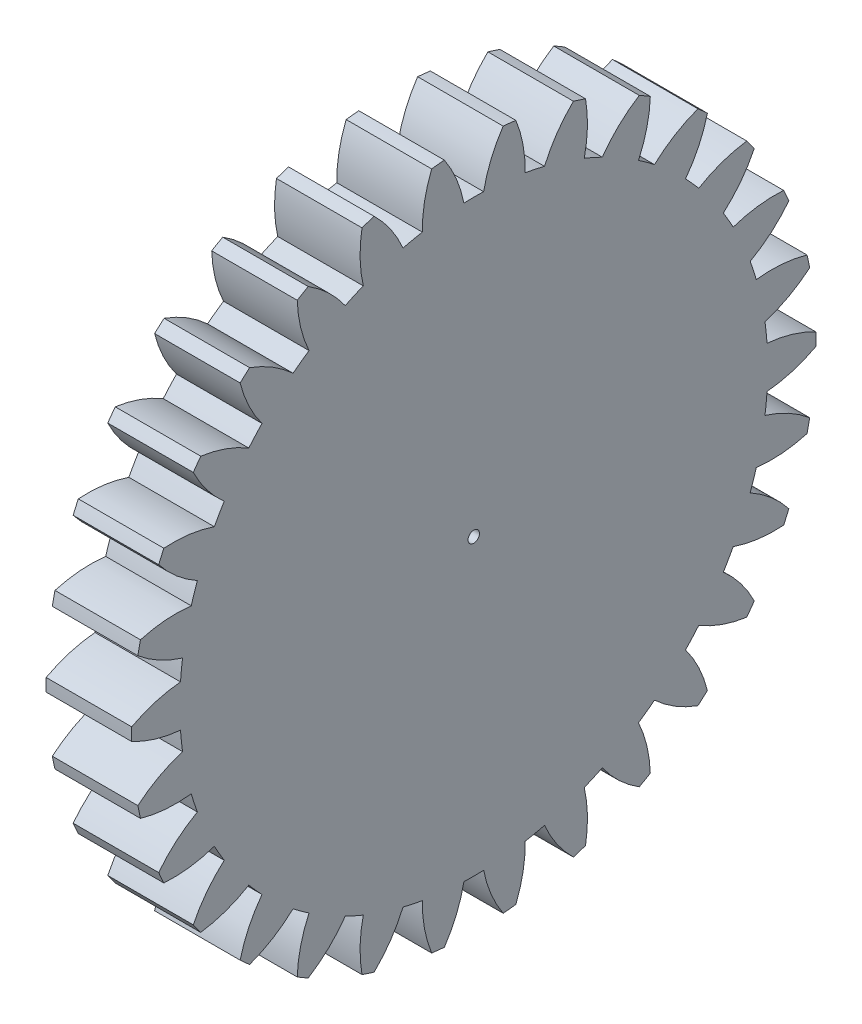
from build123d import *

# Parameters (mm, degrees)
BASPROSKE_W     = 6
BASPROSKE_H     = 24
TOOTHCUT_DEPTH  = 35.467375879
TEETHCUTS_COUNT = 30
TEETHCUTS_ANGLE = 348
BORSKE_R        = 0.4
BORE_DEPTH      = 50.0000508


with BuildPart() as part:
    # BasProSke → Base-Revolve (revolve)
    with BuildSketch(Plane(origin=(0, 0, 0), x_dir=(1, 0, 0), z_dir=(0, 1, 0)), mode=Mode.PRIVATE) as base_revolve_sk:
        with Locations((3, 12)):
            Rectangle(BASPROSKE_W, BASPROSKE_H)
    revolve(base_revolve_sk.sketch.rotate(Axis((-10, 0, 0), (1, 0, 0)), 180), axis=Axis((-10, 0, 0), (1, 0, 0)))

    # TooCutSke → ToothCut (cut, through all)
    with BuildSketch(Plane(origin=(0, 0, 0), x_dir=(0, 0, -1), z_dir=(1, 0, 0))):
        with BuildLine():
            ThreePointArc((0.693278797, 20.612344372), (0, 20.624), (-0.693278797, 20.612344372))
            ThreePointArc((-0.693278797, 20.612344372), (-1.219042225, 22.34383125), (-2.080549663, 23.935144835))
            ThreePointArc((-2.080549663, 23.935144835), (0, 24.0254), (2.080549663, 23.935144835))
            ThreePointArc((2.080549663, 23.935144835), (1.219042225, 22.34383125), (0.693278797, 20.612344372))
        make_face()
    toothcut = extrude(amount=TOOTHCUT_DEPTH, mode=Mode.SUBTRACT)

    # TeethCuts: ToothCut ×30 about axis
    teethcuts_axis = Axis((-10, 0, 0), (1, 0, 0))
    for i in range(1, TEETHCUTS_COUNT):
        add(toothcut.rotate(teethcuts_axis, i * TEETHCUTS_ANGLE / (TEETHCUTS_COUNT - 1)), mode=Mode.SUBTRACT)

    # BorSke → Bore (cut, symmetric)
    with BuildSketch(Plane(origin=(0, 0, 0), x_dir=(0, 0, -1), z_dir=(1, 0, 0))):
        with Locations(Location((0, 0, 0), (0, 0, 180))):
            Circle(BORSKE_R)
    extrude(amount=BORE_DEPTH, both=True, mode=Mode.SUBTRACT)


solid = part.part
